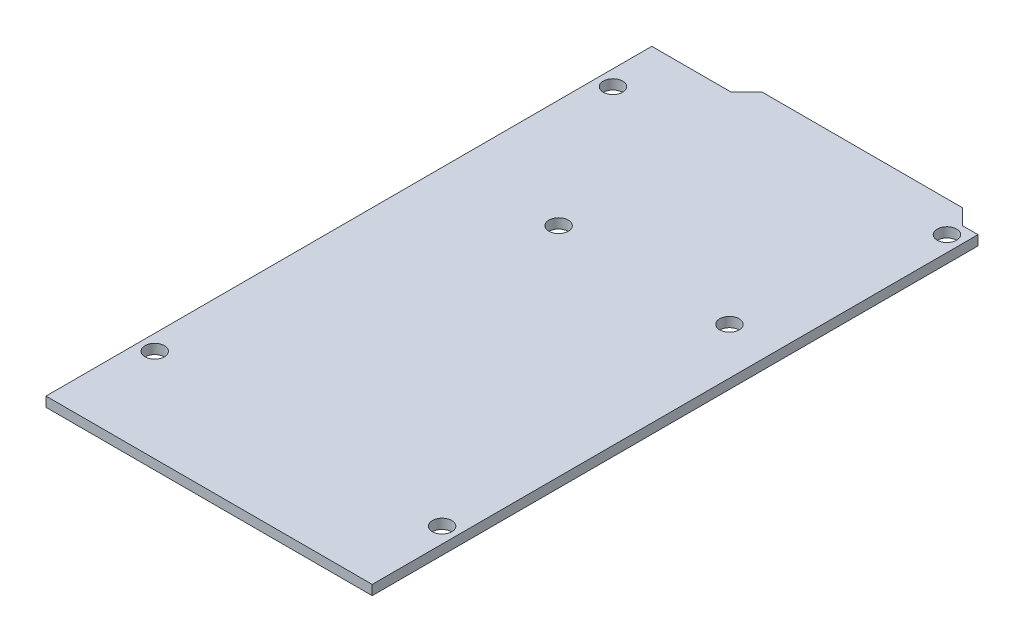
from build123d import *

# Parameters (mm, degrees)
SKETCH1_R           = 1.5875
BOSS_EXTRUDE1_DEPTH = 1.6


with BuildPart() as part:
    # Sketch1 → Boss-Extrude1 (new body)
    with BuildSketch(Plane(origin=(0, 0, 0), x_dir=(1, 0, 0), z_dir=(0, 1, 0))):
        Polygon((0, 0), (-53.34, 0), (-53.34, 99.06), (-40.386, 99.06), (-37.846, 101.6), (-5.08, 101.6), (-2.54, 99.06), (0, 99.06), align=None)
        with Locations(Location((-7.62, 66.04, 0), (0, 0, 270))):
            Circle(SKETCH1_R, mode=Mode.SUBTRACT)
        with Locations(Location((-35.56, 66.04, 0), (0, 0, 270))):
            Circle(SKETCH1_R, mode=Mode.SUBTRACT)
        with Locations(Location((-2.54, 13.97, 0), (0, 0, 270))):
            Circle(SKETCH1_R, mode=Mode.SUBTRACT)
        with Locations(Location((-50.8, 15.24, 0), (0, 0, 270))):
            Circle(SKETCH1_R, mode=Mode.SUBTRACT)
        with Locations(Location((-2.54, 96.52, 0), (0, 0, 270))):
            Circle(SKETCH1_R, mode=Mode.SUBTRACT)
        with Locations(Location((-50.8, 90.17, 0), (0, 0, 270))):
            Circle(SKETCH1_R, mode=Mode.SUBTRACT)
    extrude(amount=-BOSS_EXTRUDE1_DEPTH)


solid = part.part
